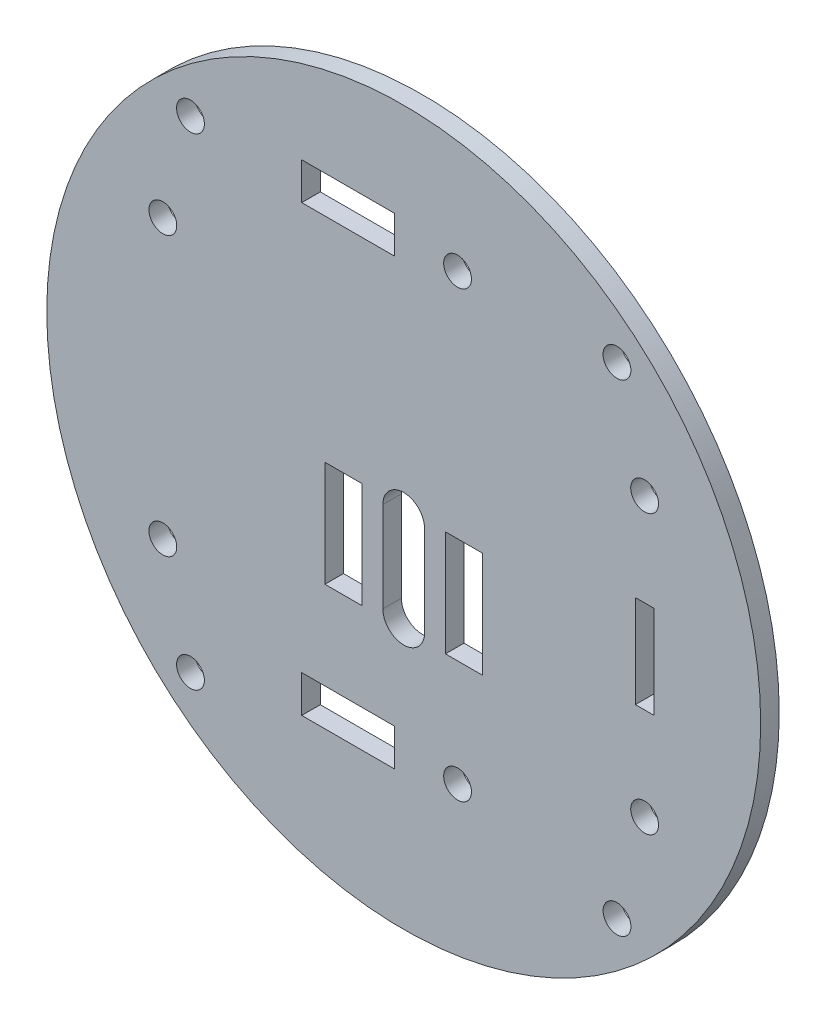
from build123d import *

# Parameters (mm, degrees)
MODEL_R             = 38.5
MODEL_R_2           = 1.5
MODEL_W             = 10
MODEL_H             = 4
MODEL_W_2           = 4
MODEL_H_2           = 11.4
MODEL_W_3           = 2
MODEL_H_3           = 10
BOSS_EXTRUDE1_DEPTH = 2


with BuildPart() as part:
    # Model → Boss-Extrude1 (new body)
    with BuildSketch(Plane.XY):
        with Locations((2103.994457195, 1132.586491316)):
            Circle(MODEL_R)
        with Locations((2078.013695082, 1147.586491316)):
            Circle(MODEL_R_2, mode=Mode.SUBTRACT)
        with Locations((2129.975219309, 1147.586491316)):
            Circle(MODEL_R_2, mode=Mode.SUBTRACT)
        with Locations((2129.975219309, 1117.586491316)):
            Circle(MODEL_R_2, mode=Mode.SUBTRACT)
        with Locations((2078.013695082, 1117.586491316)):
            Circle(MODEL_R_2, mode=Mode.SUBTRACT)
        with Locations((2109.800475531, 1158.486491316)):
            Circle(MODEL_R_2, mode=Mode.SUBTRACT)
        with Locations((2109.800475531, 1110.586491316)):
            Circle(MODEL_R_2, mode=Mode.SUBTRACT)
        with Locations((2080.994457195, 1106.605729203)):
            Circle(MODEL_R_2, mode=Mode.SUBTRACT)
        with Locations((2080.994457195, 1158.56725343)):
            Circle(MODEL_R_2, mode=Mode.SUBTRACT)
        with Locations((2126.994457195, 1106.605729203)):
            Circle(MODEL_R_2, mode=Mode.SUBTRACT)
        with Locations((2126.994457195, 1158.56725343)):
            Circle(MODEL_R_2, mode=Mode.SUBTRACT)
        with Locations((2097.994457195, 1158.486491316)):
            Rectangle(MODEL_W, MODEL_H, mode=Mode.SUBTRACT)
        with Locations((2097.994457195, 1110.586491316)):
            Rectangle(MODEL_W, MODEL_H, mode=Mode.SUBTRACT)
        with Locations((2097.494457195, 1127.786491316)):
            Rectangle(MODEL_W_2, MODEL_H_2, mode=Mode.SUBTRACT)
        with Locations((2110.494457195, 1127.786491316)):
            Rectangle(MODEL_W_2, MODEL_H_2, mode=Mode.SUBTRACT)
        with BuildLine():
            Line((2101.744457195, 1132.659888489), (2101.744457195, 1122.913094144))
            ThreePointArc((2101.744457195, 1122.913094144), (2103.994457195, 1120.663094144), (2106.244457195, 1122.913094144))
            Line((2106.244457195, 1122.913094144), (2106.244457195, 1132.659888489))
            ThreePointArc((2106.244457195, 1132.659888489), (2103.994457195, 1134.909888489), (2101.744457195, 1132.659888489))
        make_face(mode=Mode.SUBTRACT)
        with Locations((2129.976886457, 1132.586491316)):
            Rectangle(MODEL_W_3, MODEL_H_3, mode=Mode.SUBTRACT)
    extrude(amount=BOSS_EXTRUDE1_DEPTH)


solid = part.part
